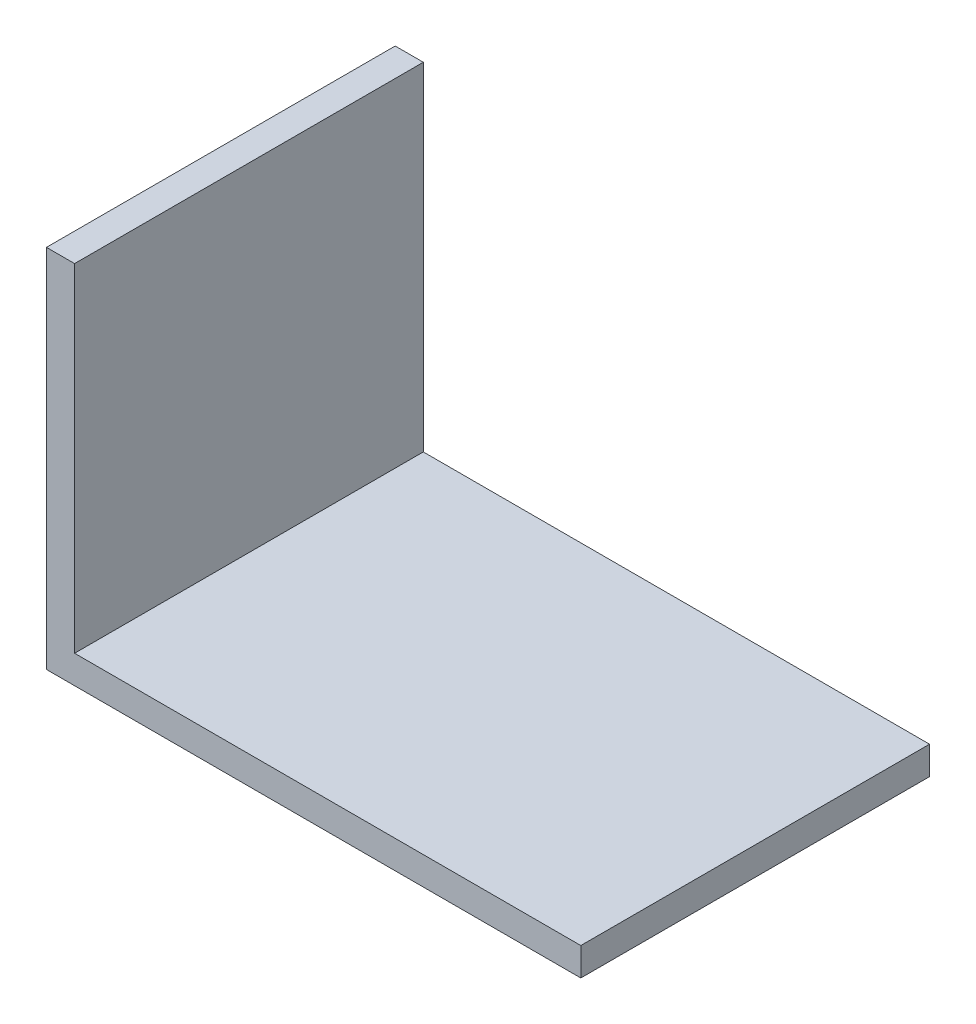
from build123d import *

# Parameters (mm, degrees)
SKETCH1_W           = 31
SKETCH1_H           = 30
BOSS_EXTRUDE1_DEPTH = 2.5
SKETCH2_W           = 31
SKETCH2_H           = 2.5
BOSS_EXTRUDE2_DEPTH = 47.5


with BuildPart() as part:
    # Sketch1 → Boss-Extrude1 (new body)
    with BuildSketch(Plane(origin=(0, 0, 0), x_dir=(0, 0, -1), z_dir=(1, 0, 0))):
        Rectangle(SKETCH1_W, SKETCH1_H)
    extrude(amount=BOSS_EXTRUDE1_DEPTH)

    # Sketch2 → Boss-Extrude2 (add)
    with BuildSketch(Plane(origin=(0, 0, 0), x_dir=(0, 0, -1), z_dir=(1, 0, 0))):
        with Locations((0, -16.25)):
            Rectangle(SKETCH2_W, SKETCH2_H)
    extrude(amount=BOSS_EXTRUDE2_DEPTH)


solid = part.part
